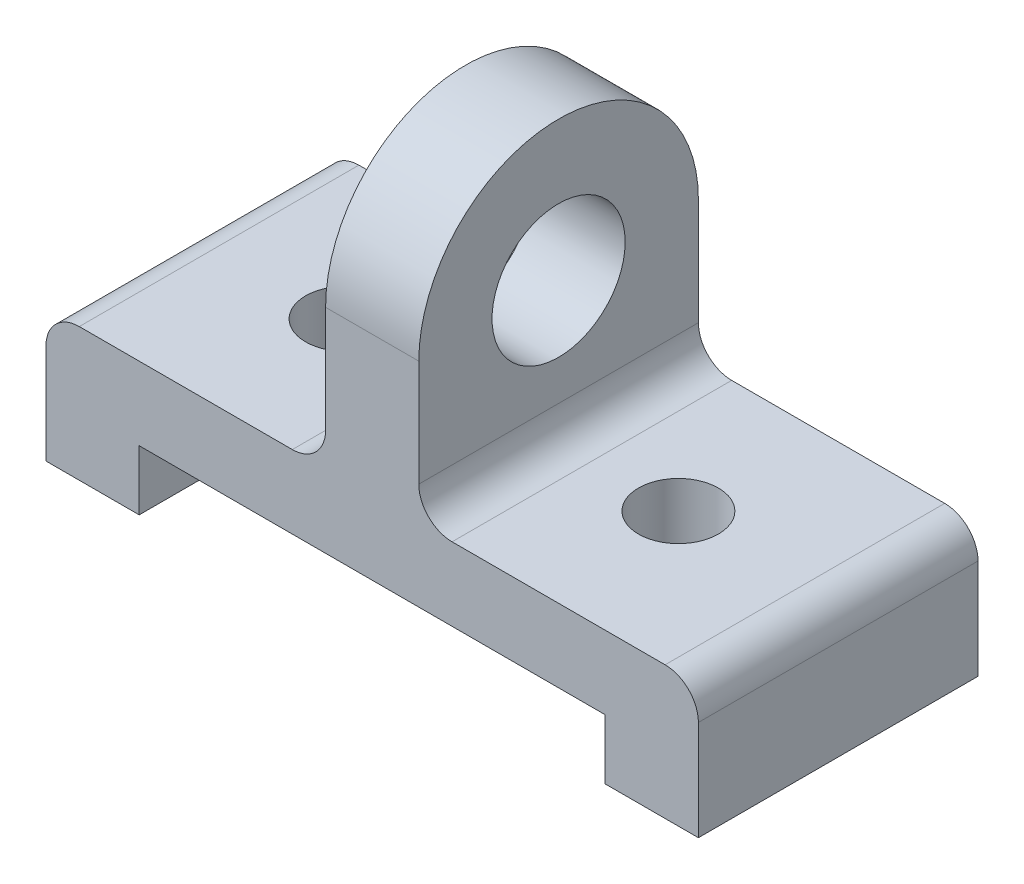
from build123d import *

# Parameters (mm, degrees)
SKETCH1_W           = 98
SKETCH1_H           = 42
BOSS_EXTRUDE1_DEPTH = 10
SKETCH2_W           = 70
SKETCH2_H           = 9
CUT_EXTRUDE1_DEPTH  = 42
SKETCH4_W           = 42
SKETCH4_H           = 42
BOSS_EXTRUDE3_DEPTH = 7
FILLET1_RADIUS      = 21
FILLET1_LENGTH      = 14
SKETCH5_R           = 10
CUT_EXTRUDE2_DEPTH  = 14
SKETCH6_R           = 6
CUT_EXTRUDE3_DEPTH  = 14
FILLET2_R           = 5
FILLET3_R           = 5


with BuildPart() as part:
    # Sketch1 → Boss-Extrude1 (new, symmetric)
    with BuildSketch(Plane(origin=(0, 0, 0), x_dir=(1, 0, 0), z_dir=(0, 1, 0))):
        Rectangle(SKETCH1_W, SKETCH1_H)
    extrude(amount=BOSS_EXTRUDE1_DEPTH, both=True)

    # Sketch2 → Cut-Extrude1 (cut)
    with BuildSketch(Plane.XY.offset(21)):
        with Locations((0, -5.5)):
            Rectangle(SKETCH2_W, SKETCH2_H)
    extrude(amount=-CUT_EXTRUDE1_DEPTH, mode=Mode.SUBTRACT)

    # Sketch4 → Boss-Extrude3 (add, symmetric)
    with BuildSketch(Plane(origin=(0, 0, 0), x_dir=(0, 0, -1), z_dir=(1, 0, 0))):
        with Locations((0, 31)):
            Rectangle(SKETCH4_W, SKETCH4_H)
    extrude(amount=BOSS_EXTRUDE3_DEPTH, both=True)

    # Fillet1: full round fillet: the end face becomes a half cylinder, R = half its width
    fillet1_face = Plane((0, 52, 0), x_dir=(-1, 0, 0), z_dir=(0, 1, 0))  # on the end face: x along it, z out of the body
    fillet1_slab = fillet1_face.offset(-FILLET1_RADIUS / 2) * Box(FILLET1_LENGTH, 2 * FILLET1_RADIUS, FILLET1_RADIUS, mode=Mode.PRIVATE)  # the body's end, R deep
    fillet1_round = Plane((0, 31, 0), x_dir=(0, 1, 0), z_dir=(-1, 0, 0)) * Cylinder(FILLET1_RADIUS, FILLET1_LENGTH, mode=Mode.PRIVATE)  # its axis R under the face
    add(fillet1_slab - fillet1_round, mode=Mode.SUBTRACT)

    # Sketch5 → Cut-Extrude2 (cut)
    with BuildSketch(Plane(origin=(7, 0, 0), x_dir=(0, 0, -1), z_dir=(1, 0, 0))):
        with Locations((0, 31)):
            Circle(SKETCH5_R)
    extrude(amount=-CUT_EXTRUDE2_DEPTH, mode=Mode.SUBTRACT)

    # Sketch6 → Cut-Extrude3 (cut)
    with BuildSketch(Plane(origin=(0, 10, 0), x_dir=(1, 0, 0), z_dir=(0, 1, 0))):
        with Locations(Location((25, 0, 0), (0, 0, 270))):
            Circle(SKETCH6_R)
        with Locations(Location((-25, 0, 0), (0, 0, 270))):
            Circle(SKETCH6_R)
    extrude(amount=-CUT_EXTRUDE3_DEPTH, mode=Mode.SUBTRACT)

    # Fillet2
    fillet2_edges = [part.edges().sort_by_distance(p)[0] for p in [
        (-49, 10, 0),
        (49, 10, 0),
    ]]
    fillet(fillet2_edges, radius=FILLET2_R)

    # Fillet3
    fillet3_edges = [part.edges().sort_by_distance(p)[0] for p in [
        (-7, 10, 0),
        (7, 10, 0),
    ]]
    fillet(fillet3_edges, radius=FILLET3_R)


solid = part.part
